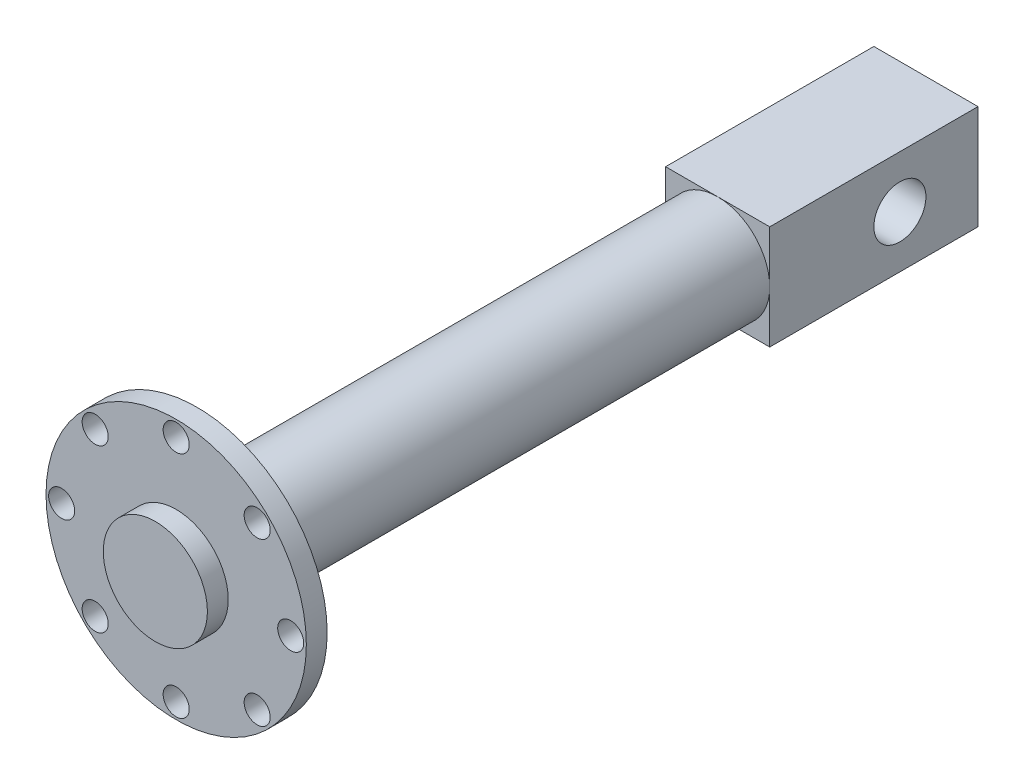
from build123d import *

# Parameters (mm, degrees)
SKIZZE1_W                       = 10
SKIZZE1_H                       = 10
AUFSATZ_LINEAR_AUSTRAGEN1_DEPTH = 20
SKIZZE2_R                       = 2.5
SCHNITT_LINEAR_AUSTRAGEN1_DEPTH = 20
SKIZZE3_R                       = 5
AUFSATZ_LINEAR_AUSTRAGEN2_DEPTH = 50
SKIZZE4_R                       = 12.5
AUFSATZ_LINEAR_AUSTRAGEN3_DEPTH = 2
SKIZZE5_R                       = 1.25
SCHNITT_LINEAR_AUSTRAGEN2_DEPTH = 5
SKIZZE6_R                       = 5
AUFSATZ_LINEAR_AUSTRAGEN4_DEPTH = 2


with BuildPart() as part:
    # Skizze1 → Aufsatz-Linear austragen1 (new body)
    with BuildSketch(Plane.XY):
        Rectangle(SKIZZE1_W, SKIZZE1_H)
    extrude(amount=AUFSATZ_LINEAR_AUSTRAGEN1_DEPTH)

    # Skizze2 → Schnitt-Linear austragen1 (cut)
    with BuildSketch(Plane(origin=(5, 0, 0), x_dir=(0, 0, -1), z_dir=(1, 0, 0))):
        with Locations(Location((-7.5, 0, 0), (0, 0, 90))):
            Circle(SKIZZE2_R)
    extrude(amount=-SCHNITT_LINEAR_AUSTRAGEN1_DEPTH, mode=Mode.SUBTRACT)

    # Skizze3 → Aufsatz-Linear austragen2 (add)
    with BuildSketch(Plane.XY.offset(20)):
        Circle(SKIZZE3_R)
    extrude(amount=AUFSATZ_LINEAR_AUSTRAGEN2_DEPTH)

    # Skizze4 → Aufsatz-Linear austragen3 (add)
    with BuildSketch(Plane.XY.offset(70)):
        Circle(SKIZZE4_R)
    extrude(amount=AUFSATZ_LINEAR_AUSTRAGEN3_DEPTH)

    # Skizze5 → Schnitt-Linear austragen2 (cut)
    with BuildSketch(Plane.XY.offset(72)):
        with Locations((0, 11)):
            Circle(SKIZZE5_R)
        with Locations((7.778174593, 7.778174593)):
            Circle(SKIZZE5_R)
        with Locations((11, 0)):
            Circle(SKIZZE5_R)
        with Locations((7.778174593, -7.778174593)):
            Circle(SKIZZE5_R)
        with Locations((0, -11)):
            Circle(SKIZZE5_R)
        with Locations((-7.778174593, -7.778174593)):
            Circle(SKIZZE5_R)
        with Locations((-11, 0)):
            Circle(SKIZZE5_R)
        with Locations((-7.778174593, 7.778174593)):
            Circle(SKIZZE5_R)
    extrude(amount=-SCHNITT_LINEAR_AUSTRAGEN2_DEPTH, mode=Mode.SUBTRACT)

    # Skizze6 → Aufsatz-Linear austragen4 (add)
    with BuildSketch(Plane.XY.offset(72)):
        Circle(SKIZZE6_R)
    extrude(amount=AUFSATZ_LINEAR_AUSTRAGEN4_DEPTH)


solid = part.part
